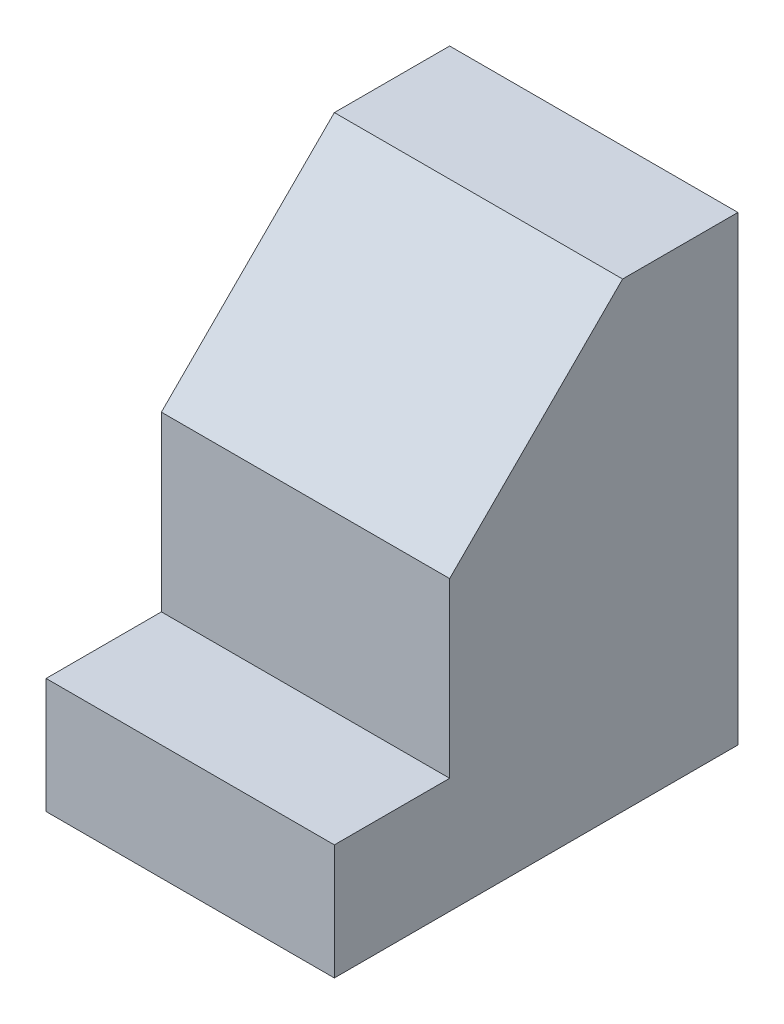
from build123d import *

# Parameters (mm, degrees)
SKETCH1_W           = 25000
SKETCH1_H           = 35000
BOSS_EXTRUDE1_DEPTH = 10000
SKETCH2_W           = 25000
SKETCH2_H           = 25000
BOSS_EXTRUDE2_DEPTH = 25000
SKETCH3_W           = 25000
SKETCH3_H           = 10000
BOSS_EXTRUDE3_DEPTH = 40000
BOSS_EXTRUDE4_DEPTH = 25000


with BuildPart() as part:
    # Sketch1 → Boss-Extrude1 (new body)
    with BuildSketch(Plane(origin=(0, 0, 0), x_dir=(1, 0, 0), z_dir=(0, 1, 0))):
        with Locations((12500, 17500)):
            Rectangle(SKETCH1_W, SKETCH1_H)
    extrude(amount=BOSS_EXTRUDE1_DEPTH)

    # Sketch2 → Boss-Extrude2 (add)
    with BuildSketch(Plane(origin=(0, 0, 0), x_dir=(1, 0, 0), z_dir=(0, 1, 0))):
        with Locations((12500, 22500)):
            Rectangle(SKETCH2_W, SKETCH2_H)
    extrude(amount=BOSS_EXTRUDE2_DEPTH)

    # Sketch3 → Boss-Extrude3 (add)
    with BuildSketch(Plane(origin=(0, 0, 0), x_dir=(1, 0, 0), z_dir=(0, 1, 0))):
        with Locations((12500, 30000)):
            Rectangle(SKETCH3_W, SKETCH3_H)
    extrude(amount=BOSS_EXTRUDE3_DEPTH)

    # Sketch4 → Boss-Extrude4 (add)
    with BuildSketch(Plane(origin=(0, 0, 0), x_dir=(0, 0, -1), z_dir=(1, 0, 0))):
        Polygon((10000, 25000), (25000, 40000), (25000, 25000), align=None)
    extrude(amount=BOSS_EXTRUDE4_DEPTH)


solid = part.part
